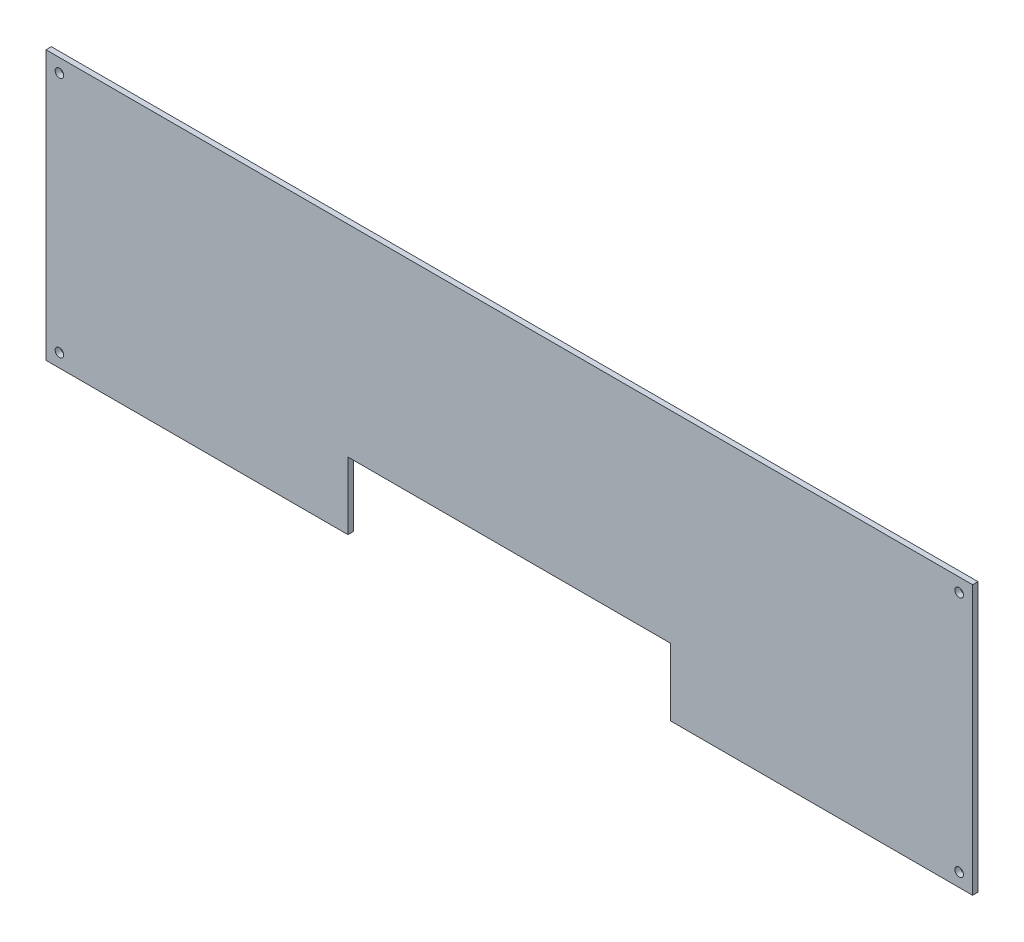
from build123d import *

# Parameters (mm, degrees)
SKETCH_1_W          = 344.5
SKETCH_1_H          = 100
EXTRUDE_1_DEPTH     = 2
SKETCH_2_R          = 1.6
CUT_EXTRUDE_1_DEPTH = 2
SKETCH_3_W          = 120
SKETCH_3_H          = 25
CUT_EXTRUDE_2_DEPTH = 10


with BuildPart() as part:
    # 草图1 → 凸台-拉伸1 (new body)
    with BuildSketch(Plane.XY):
        Rectangle(SKETCH_1_W, SKETCH_1_H)
    extrude(amount=EXTRUDE_1_DEPTH)

    # 草图2 → 切除-拉伸1 (cut)
    with BuildSketch(Plane.XY.offset(2)):
        with Locations((167.25, -45)):
            Circle(SKETCH_2_R)
        with Locations(Location((167.25, 45, 0), (0, 0, 180))):
            Circle(SKETCH_2_R)
        with Locations(Location((-167.25, -45, 0), (0, 0, 180))):
            Circle(SKETCH_2_R)
        with Locations((-167.25, 45)):
            Circle(SKETCH_2_R)
    extrude(amount=-CUT_EXTRUDE_1_DEPTH, mode=Mode.SUBTRACT)

    # 草图3 → 切除-拉伸2 (cut)
    with BuildSketch(Plane.XY.offset(2)):
        with Locations((0, -37.5)):
            Rectangle(SKETCH_3_W, SKETCH_3_H)
    extrude(amount=-CUT_EXTRUDE_2_DEPTH, mode=Mode.SUBTRACT)


solid = part.part
